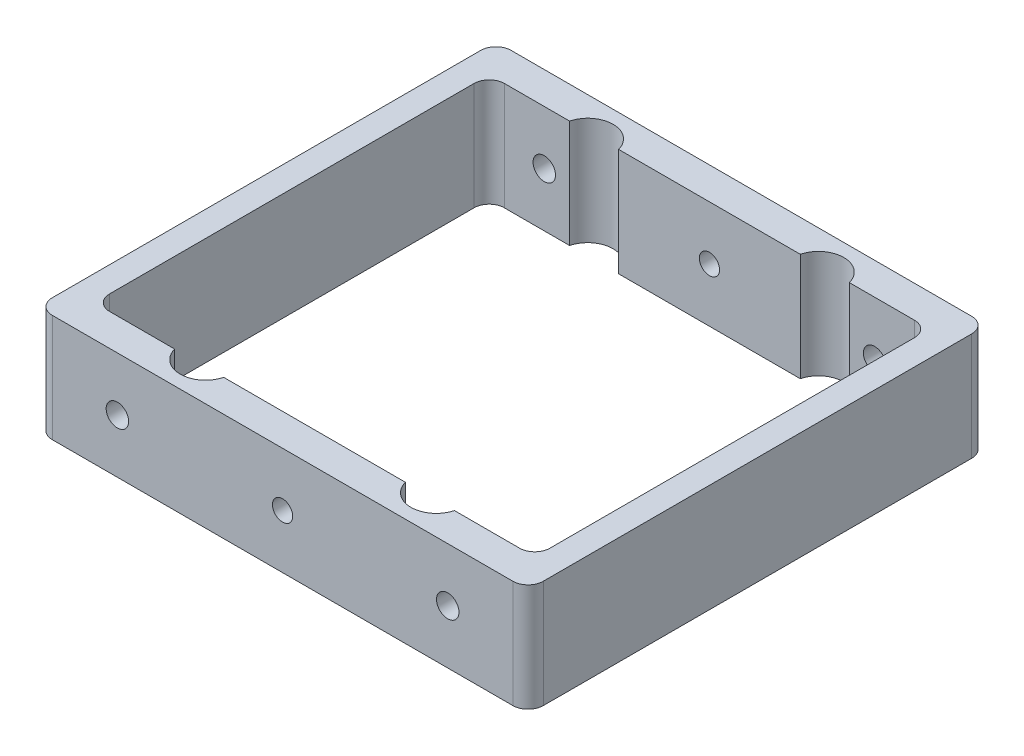
from build123d import *

# Parameters (mm, degrees)
SKETCH1_W           = 60
SKETCH1_H           = 6.32
BOSS_EXTRUDE1_DEPTH = 10.64
SKETCH2_R           = 5
CUT_EXTRUDE1_DEPTH  = 64.974845056
SKETCH3_W           = 6.32
SKETCH3_H           = 21.28
BOSS_EXTRUDE2_DEPTH = 18.5
SKETCH4_W           = 6.32
SKETCH4_H           = 21.28
BOSS_EXTRUDE3_DEPTH = 18.5
SKETCH5_W           = 5
SKETCH5_H           = 21.28
BOSS_EXTRUDE6_DEPTH = 84.33
SKETCH6_W           = 5
SKETCH6_H           = 21.291954735
BOSS_EXTRUDE7_DEPTH = 84.33
SKETCH7_W           = 6.32
SKETCH7_H           = 21.291954735
BOSS_EXTRUDE8_DEPTH = 92
SKETCH9_R           = 5
CUT_EXTRUDE2_DEPTH  = 118.162904694
SKETCH10_R          = 2.22
CUT_EXTRUDE3_DEPTH  = 121.387443862
FILLET1_R           = 3
SKETCH13_R          = 2
CUT_EXTRUDE4_DEPTH  = 121.387443862


with BuildPart() as part:
    # Sketch1 → Boss-Extrude1 (new, symmetric)
    with BuildSketch(Plane(origin=(0, 0, 0), x_dir=(1, 0, 0), z_dir=(0, 1, 0))):
        with Locations((30, -3.16)):
            Rectangle(SKETCH1_W, SKETCH1_H)
    extrude(amount=BOSS_EXTRUDE1_DEPTH, both=True)

    # Sketch2 → Cut-Extrude1 (cut, through all)
    with BuildSketch(Plane(origin=(0, 10.64, 0), x_dir=(1, 0, 0), z_dir=(0, 1, 0))):
        with Locations((7.21, 1.25)):
            Circle(SKETCH2_R)
        with Locations((52.79, 1.25)):
            Circle(SKETCH2_R)
    extrude(amount=-CUT_EXTRUDE1_DEPTH, mode=Mode.SUBTRACT)

    # Sketch3 → Boss-Extrude2 (add)
    with BuildSketch(Plane(origin=(60, 0, 0), x_dir=(0, 0, -1), z_dir=(1, 0, 0))):
        with Locations((-3.16, 0)):
            Rectangle(SKETCH3_W, SKETCH3_H)
    extrude(amount=BOSS_EXTRUDE2_DEPTH)

    # Sketch4 → Boss-Extrude3 (add)
    with BuildSketch(Plane.ZY):
        with Locations((3.16, 0)):
            Rectangle(SKETCH4_W, SKETCH4_H)
    extrude(amount=BOSS_EXTRUDE3_DEPTH)

    # Sketch5 → Boss-Extrude6 (add)
    with BuildSketch(Plane(origin=(0, 0, 0), x_dir=(-1, 0, 0), z_dir=(0, 0, -1))):
        with Locations((16, 0)):
            Rectangle(SKETCH5_W, SKETCH5_H)
    extrude(amount=BOSS_EXTRUDE6_DEPTH)

    # Sketch6 → Boss-Extrude7 (add)
    with BuildSketch(Plane(origin=(0, 0, 0), x_dir=(-1, 0, 0), z_dir=(0, 0, -1))):
        with Locations((-76, -0.005977367)):
            Rectangle(SKETCH6_W, SKETCH6_H)
    extrude(amount=BOSS_EXTRUDE7_DEPTH)

    # Sketch7 → Boss-Extrude8 (add, through all)
    with BuildSketch(Plane.ZY.offset(-73.5)):
        with Locations((-81.17, -0.005977367)):
            Rectangle(SKETCH7_W, SKETCH7_H)
    extrude(amount=BOSS_EXTRUDE8_DEPTH)

    # Sketch9 → Cut-Extrude2 (cut, through all)
    with BuildSketch(Plane(origin=(0, 10.64, 0), x_dir=(1, 0, 0), z_dir=(0, 1, 0))):
        with Locations((7.21, 76.76)):
            Circle(SKETCH9_R)
        with Locations((52.79, 76.76)):
            Circle(SKETCH9_R)
    extrude(amount=-CUT_EXTRUDE2_DEPTH, mode=Mode.SUBTRACT)

    # Sketch10 → Cut-Extrude3 (cut, through all)
    with BuildSketch(Plane(origin=(0, 0, -84.33), x_dir=(-1, 0, 0), z_dir=(0, 0, -1))):
        with Locations((-62.631229183, 0.005)):
            Circle(SKETCH10_R)
        with Locations((2.631229183, 0.005)):
            Circle(SKETCH10_R)
    extrude(amount=-CUT_EXTRUDE3_DEPTH, mode=Mode.SUBTRACT)

    # Fillet1
    fillet1_edges = [part.edges().sort_by_distance(p)[0] for p in [
        (78.5, 0, 6.32),
        (-18.5, 0, 6.32),
        (-13.5, 0, 0),
        (-18.5, -0.005977367, -84.33),
        (73.5, 0, 0),
        (78.5, -0.005977367, -84.33),
        (-13.5, 0, -78.01),
        (73.5, -0.005977367, -78.01),
    ]]
    fillet(fillet1_edges, radius=FILLET1_R)

    # Sketch13 → Cut-Extrude4 (cut, through all)
    with BuildSketch(Plane(origin=(0, 0, -84.33), x_dir=(-1, 0, 0), z_dir=(0, 0, -1))):
        with Locations((-30, 0.005)):
            Circle(SKETCH13_R)
    extrude(amount=-CUT_EXTRUDE4_DEPTH, mode=Mode.SUBTRACT)


solid = part.part
